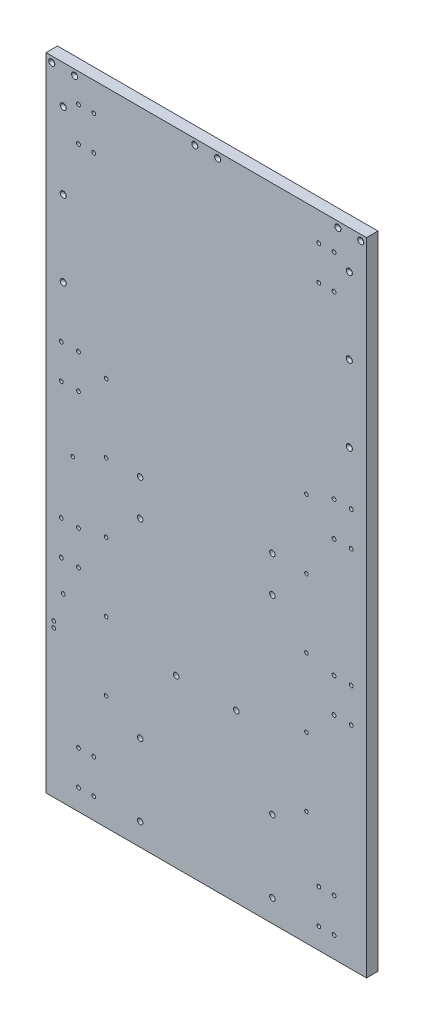
from build123d import *

# Parameters (mm, degrees)
SKETCH1_W                        = 533.146
SKETCH1_H                        = 1066.799994849
BOSS_EXTRUDE1_DEPTH              = 19.05
F_23_64_0_35938_DIAMETER_HOLE1_D = 9.128252
F_15_64_0_23438_DIAMETER_HOLE1_D = 5.953252
F_1_4_0_25_DIAMETER_HOLE1_D      = 6.35
F_15_64_0_23438_DIAMETER_HOLE2_D = 5.953252
HOLE1_D                          = 3.175
HOLE1_DEPTH                      = 38.1
HOLE1_CSINK_D                    = 10.16
HOLE1_CSINK_ANGLE                = 82
HOLE1_TIP                        = 0.953866233


with BuildPart() as part:
    # Sketch1 → Boss-Extrude1 (new body)
    with BuildSketch(Plane.XY):
        with Locations((0, 6469.379997497)):
            Rectangle(SKETCH1_W, SKETCH1_H)
    extrude(amount=-BOSS_EXTRUDE1_DEPTH)

    # 23/64 (0.35938) Diameter Hole1 (through all)
    with Locations(Plane(origin=(0, 0, -19.05), x_dir=(-1, 0, 0), z_dir=(0, 0, -1))):
        with Locations((110, 5973.262000072), (110, 6093.262000072), (-110, 6093.262000072), (-110, 5973.262000072), (-50, 6213.262000072), (50, 6213.262000072), (-110, 6409.662000072), (-110, 6469.662000072), (110, 6409.662000072), (110, 6469.662000072)):
            Hole(F_23_64_0_35938_DIAMETER_HOLE1_D / 2)

    # 15/64 (0.23438) Diameter Hole1 (through all)
    with Locations(Plane(origin=(0, 0, -19.05), x_dir=(-1, 0, 0), z_dir=(0, 0, -1))):
        with Locations((166.6875, 6125.895804781), (166.6875, 6240.195804781), (166.6875, 6354.495804781), (166.6875, 6468.795804781), (166.6875, 6583.095804781), (-166.6875, 6125.895804781), (-166.6875, 6240.195804781), (-166.6875, 6354.495804781), (-166.6875, 6468.795804781), (-166.6875, 6583.095804781)):
            Hole(F_15_64_0_23438_DIAMETER_HOLE1_D / 2)

    # 1/4 (0.25) Diameter Hole1 (through all)
    with Locations(Plane.XY):
        with Locations((-212.598, 6955.154994921), (-212.598, 6898.004994921), (-187.198, 6898.004994921), (-187.198, 6955.154994921), (-241.173, 6598.970804781), (-241.173, 6541.820804781), (-212.598, 6541.820804781), (-212.598, 6598.970804781), (-212.598, 6344.970804781), (-241.173, 6344.970804781), (-241.173, 6287.820804781), (-212.598, 6287.820804781), (-212.598, 6028.055000072), (-187.198, 6028.055000072), (-187.198, 5970.905000072), (-212.598, 5970.905000072), (212.598, 5970.905000072), (187.198, 5970.905000072), (187.198, 6028.055000072), (212.598, 6028.055000072), (212.598, 6287.820804781), (241.173, 6287.820804781), (241.173, 6344.970804781), (212.598, 6344.970804781), (212.598, 6598.970804781), (212.598, 6541.820804781), (241.173, 6541.820804781), (241.173, 6598.970804781), (187.198, 6955.154994921), (187.198, 6898.004994921), (212.598, 6898.004994921), (212.598, 6955.154994921)):
            Hole(F_1_4_0_25_DIAMETER_HOLE1_D / 2)

    # 15/64 (0.23438) Diameter Hole2 (through all)
    with Locations(Plane(origin=(0, 0, -19.05), x_dir=(-1, 0, 0), z_dir=(0, 0, -1))):
        with Locations((222.123, 6442.787309643), (253.823, 6180.329994921), (253.823, 6190.329994921), (237.948, 6237.312899851)):
            Hole(F_15_64_0_23438_DIAMETER_HOLE2_D / 2)

    # Hole1
    with Locations(Plane.XY):
        with Locations((-237.998, 6686.191891629), (237.998, 6686.191891629), (257.048, 6993.254994921), (218.948, 6993.254994921), (19.05, 6993.254994921), (237.998, 6939.279994921), (237.998, 6812.735943275), (-237.998, 6812.735943275), (-237.998, 6939.279994921), (-19.05, 6993.254994921), (-218.948, 6993.254994921), (-257.048, 6993.254994921)):
            CounterSinkHole(HOLE1_D / 2, HOLE1_CSINK_D / 2, depth=HOLE1_DEPTH, counter_sink_angle=HOLE1_CSINK_ANGLE)
            with Locations((0, 0, -(HOLE1_DEPTH + HOLE1_TIP / 2))):  # 118° drill point
                Cone(0, HOLE1_D / 2, HOLE1_TIP, mode=Mode.SUBTRACT)


solid = part.part
